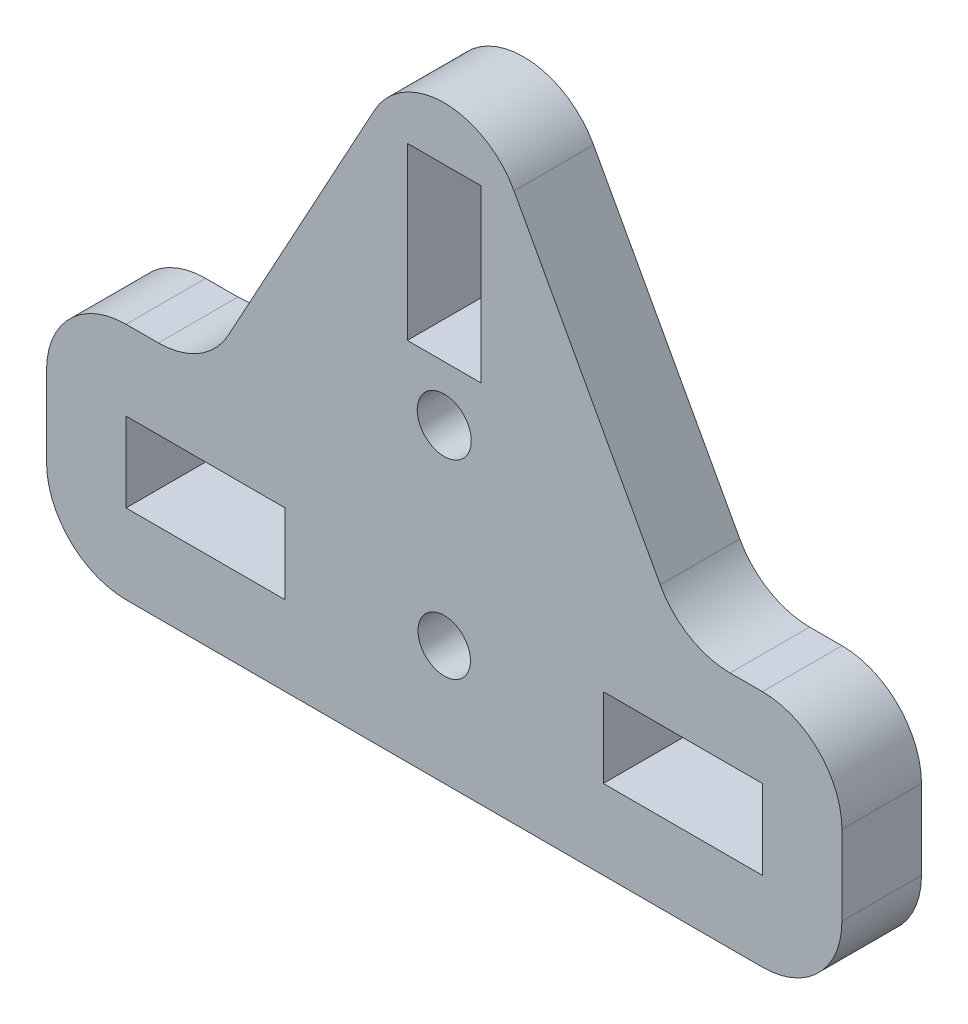
from build123d import *

# Parameters (mm, degrees)
SKETCH1_W           = 63.5
SKETCH1_H           = 19.05
BOSS_EXTRUDE1_DEPTH = 6.35
SKETCH2_R           = 2.0955
SKETCH2_W           = 12.7
SKETCH2_H           = 6.35
CUT_EXTRUDE1_DEPTH  = 6.35
BOSS_EXTRUDE2_DEPTH = 6.35
SKETCH4_R           = 2.159
SKETCH4_W           = 5.8928
SKETCH4_H           = 13.6271
CUT_EXTRUDE3_DEPTH  = 6.35
FILLET1_R           = 6.35


with BuildPart() as part:
    # Sketch1 → Boss-Extrude1 (new body)
    with BuildSketch(Plane.XY):
        Rectangle(SKETCH1_W, SKETCH1_H)
    extrude(amount=BOSS_EXTRUDE1_DEPTH)

    # Sketch2 → Cut-Extrude1 (cut)
    with BuildSketch(Plane.XY.offset(6.35)):
        Circle(SKETCH2_R)
        with Locations((-19.05, 0)):
            Rectangle(SKETCH2_W, SKETCH2_H)
        with Locations((19.05, 0)):
            Rectangle(SKETCH2_W, SKETCH2_H)
    extrude(amount=-CUT_EXTRUDE1_DEPTH, mode=Mode.SUBTRACT)

    # Sketch3 → Boss-Extrude2 (add)
    with BuildSketch(Plane.XY.offset(6.35)):
        with BuildLine():
            Line((-19.05, 9.525), (0, 9.525))
            Line((0, 9.525), (0, 24.839121342))
            ThreePointArc((0, 24.839121342), (-5.460357863, 27.947672283), (-5.574636807, 34.229832521))
            Line((-5.574636807, 34.229832521), (-19.05, 9.525))
        make_face()
        with BuildLine():
            ThreePointArc((-5.574636807, 34.229832521), (-5.460357863, 27.947672283), (0, 24.839121342))
            Line((0, 24.839121342), (0, 37.539121342))
            ThreePointArc((0, 37.539121342), (-3.24144906, 36.649479205), (-5.574636807, 34.229832521))
        make_face()
        with BuildLine():
            Line((0, 37.539121342), (0, 24.839121342))
            ThreePointArc((0, 24.839121342), (4.490128061, 26.698993282), (6.35, 31.189121342))
            ThreePointArc((6.35, 31.189121342), (6.15310672, 32.758126662), (5.574636947, 34.229832265))
            ThreePointArc((5.574636947, 34.229832265), (3.241449185, 36.649479131), (0, 37.539121342))
        make_face()
        with BuildLine():
            Line((0, 24.839121342), (0, 9.525))
            Line((0, 9.525), (19.05, 9.525))
            Line((19.05, 9.525), (5.574636947, 34.229832265))
            ThreePointArc((5.574636947, 34.229832265), (6.15310672, 32.758126662), (6.35, 31.189121342))
            ThreePointArc((6.35, 31.189121342), (4.490128061, 26.698993282), (0, 24.839121342))
        make_face()
    extrude(amount=-BOSS_EXTRUDE2_DEPTH)

    # Sketch4 → Cut-Extrude3 (cut)
    with BuildSketch(Plane(origin=(0, 0, 0), x_dir=(-1, 0, 0), z_dir=(0, 0, -1))):
        with Locations((0, 15.24)):
            Circle(SKETCH4_R)
        with Locations((0, 26.449976884)):
            Rectangle(SKETCH4_W, SKETCH4_H)
    extrude(amount=-CUT_EXTRUDE3_DEPTH, mode=Mode.SUBTRACT)

    # Fillet1
    fillet1_edges = [part.edges().sort_by_distance(p)[0] for p in [
        (31.75, -9.525, 3.175),
        (31.75, 9.525, 3.175),
        (19.05, 9.525, 3.175),
        (-31.75, -9.525, 3.175),
        (-31.75, 9.525, 3.175),
        (-19.05, 9.525, 3.175),
    ]]
    fillet(fillet1_edges, radius=FILLET1_R)


solid = part.part
